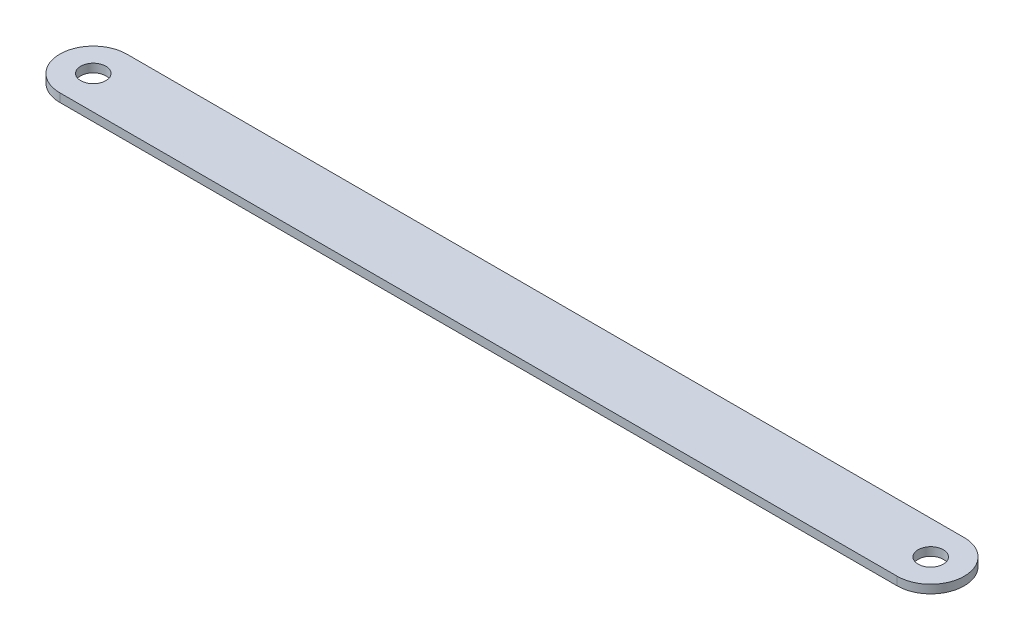
from build123d import *

# Parameters (mm, degrees)
SKETCH1_R           = 1.5
BOSS_EXTRUDE1_DEPTH = 1


with BuildPart() as part:
    # Sketch1 → Boss-Extrude1 (new body)
    with BuildSketch(Plane(origin=(0, 0, 0), x_dir=(1, 0, 0), z_dir=(0, 1, 0))):
        with BuildLine():
            Line((50, -4), (-50, -4))
            ThreePointArc((-50, -4), (-54, 0), (-50, 4))
            Line((-50, 4), (50, 4))
            ThreePointArc((50, 4), (54, 0), (50, -4))
        make_face()
        with Locations(Location((-50, 0, 0), (0, 0, 270))):
            Circle(SKETCH1_R, mode=Mode.SUBTRACT)
        with Locations(Location((50, 0, 0), (0, 0, 270))):
            Circle(SKETCH1_R, mode=Mode.SUBTRACT)
    extrude(amount=BOSS_EXTRUDE1_DEPTH)


solid = part.part
